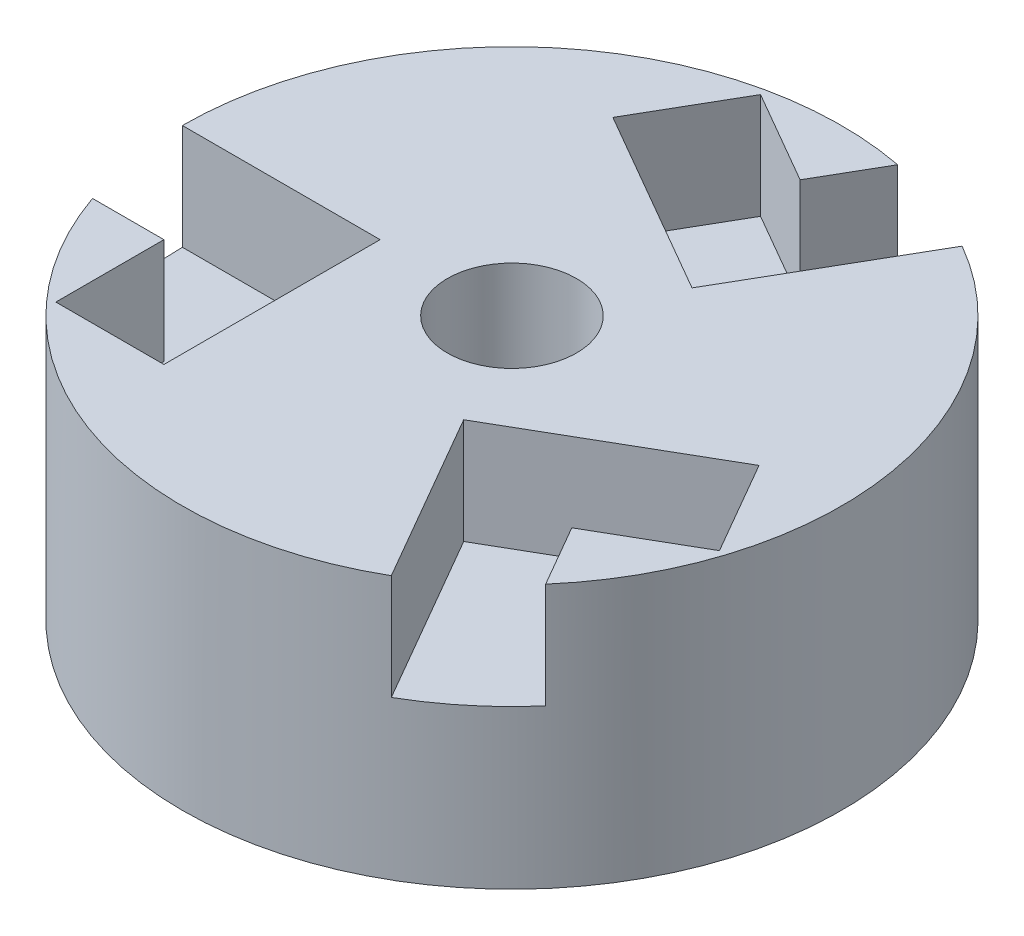
from build123d import *

# Parameters (mm, degrees)
SKETCH1_R           = 25
BOSS_EXTRUDE1_DEPTH = 20
CUT_EXTRUDE1_START  = -8
CUT_EXTRUDE1_DEPTH  = 8
CIRPATTERN1_COUNT   = 3
SKETCH7_R           = 15.1
CUT_EXTRUDE3_DEPTH  = 8.7
SKETCH8_R           = 4.9
CUT_EXTRUDE4_DEPTH  = 38.117246665


with BuildPart() as part:
    # Sketch1 → Boss-Extrude1 (new body)
    with BuildSketch(Plane(origin=(0, 0, 0), x_dir=(1, 0, 0), z_dir=(0, 1, 0))):
        with Locations(Location((0, 0, 0), (0, 0, 270))):
            Circle(SKETCH1_R)
    extrude(amount=BOSS_EXTRUDE1_DEPTH)

    # Sketch2 → Cut-Extrude1 (cut)
    with BuildSketch(Plane(origin=(0, 20, 0), x_dir=(1, 0, 0), z_dir=(0, 1, 0)).offset(CUT_EXTRUDE1_START)):
        with BuildLine():
            Line((-25, 0), (-10, 0))
            Line((-10, 0), (-10, -16.4))
            Line((-10, -16.4), (-18.2, -16.4))
            Line((-18.2, -16.4), (-18.2, -8.2))
            Line((-18.2, -8.2), (-23.616943071, -8.2))
            ThreePointArc((-23.616943071, -8.2), (-24.651811057, -4.157909525), (-25, 0))
        make_face()
    cut_extrude1 = extrude(amount=CUT_EXTRUDE1_DEPTH, mode=Mode.SUBTRACT)

    # CirPattern1: Cut-Extrude1 ×3 about axis
    cirpattern1_axis = Axis((0, 0, 0), (0, 1, 0))
    for i in range(1, CIRPATTERN1_COUNT):
        add(cut_extrude1.rotate(cirpattern1_axis, i * 360 / CIRPATTERN1_COUNT), mode=Mode.SUBTRACT)

    # Sketch7 → Cut-Extrude3 (cut)
    with BuildSketch(Plane.XZ):
        with Locations(Location((0, 0, 0), (0, 0, 270))):
            Circle(SKETCH7_R)
    extrude(amount=-CUT_EXTRUDE3_DEPTH, mode=Mode.SUBTRACT)

    # Sketch8 → Cut-Extrude4 (cut, through all)
    with BuildSketch(Plane.XZ.offset(-8.7)):
        with Locations(Location((0, 0, 0), (0, 0, 270))):
            Circle(SKETCH8_R)
    extrude(amount=-CUT_EXTRUDE4_DEPTH, mode=Mode.SUBTRACT)


solid = part.part
